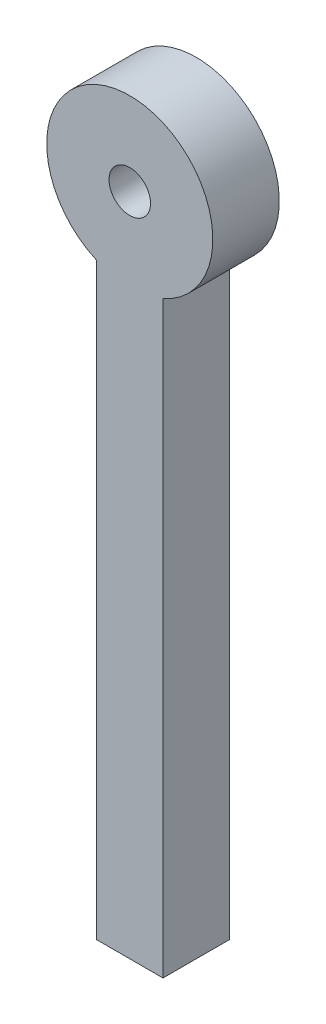
from build123d import *

# Parameters (mm, degrees)
EXTRUDE_2_DEPTH    = 8
HOLE_WIZARD_M6_1_D = 5


with BuildPart() as part:
    # 草图1 → 凸台-拉伸2 (new body)
    with BuildSketch(Plane.XY):
        with BuildLine():
            Line((-4, -9.16515139), (-4, -80))
            Line((-4, -80), (4, -80))
            Line((4, -80), (4, -9.16515139))
            ThreePointArc((4, -9.16515139), (0, 10), (-4, -9.16515139))
        make_face()
    extrude(amount=EXTRUDE_2_DEPTH)

    # M6 螺纹孔1 (through all)
    with Locations(Plane.XY.offset(8)):
        with Locations((0, 0)):
            Hole(HOLE_WIZARD_M6_1_D / 2)


solid = part.part
